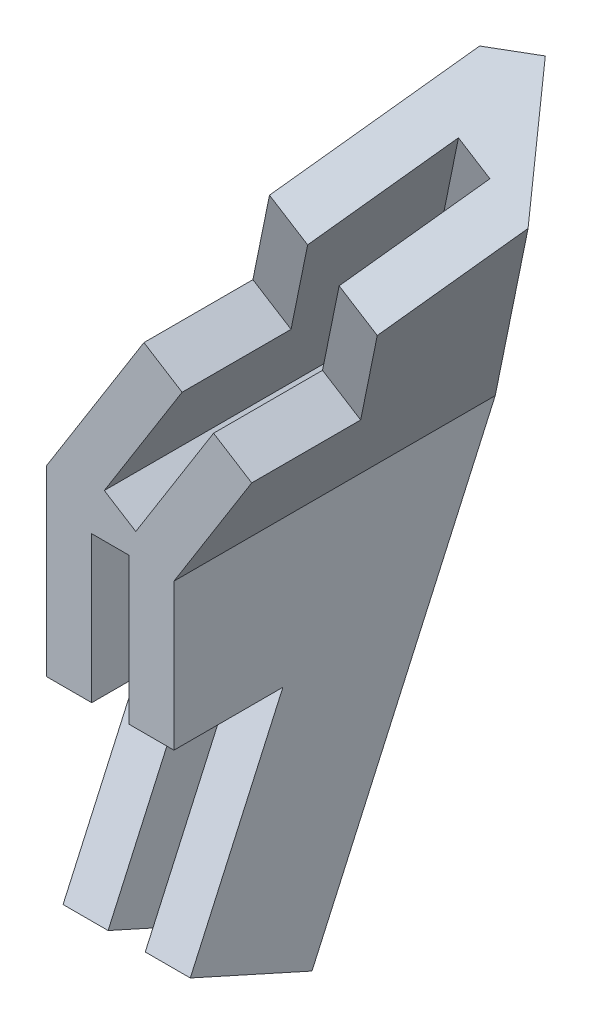
from build123d import *

# Parameters (mm, degrees)
BOSS_EXTRUDE3_DEPTH = 30
CUT_EXTRUDE1_DEPTH  = 36.393360959
SKETCH12_W          = 4
SKETCH12_H          = 13
BOSS_EXTRUDE4_DEPTH = 30
BOSS_EXTRUDE9_REACH = 63.617
CUT_EXTRUDE3_DEPTH  = 55.655521025
CUT_EXTRUDE4_REACH  = 52.517


with BuildPart() as part:
    # Sketch7 → Boss-Extrude3 (new body)
    with BuildSketch(Plane.XY):
        Polygon((-1.7, -2), (-1.7, -15), (-5.7, -15), (-5.7, -2), (-9, -2), (-9, -15), (-13, -15), (-13, 1.250897452), align=None)
    extrude(amount=BOSS_EXTRUDE3_DEPTH)

    # Sketch11 → Cut-Extrude1 (cut, through all)
    with BuildSketch(Plane.ZY.offset(13)):
        Polygon((0, 1.250897452), (7.323081285, -15), (0, -15), align=None)
    extrude(amount=-CUT_EXTRUDE1_DEPTH, mode=Mode.SUBTRACT)

    # Sketch12 → Boss-Extrude4 (add, along a direction that is not the sketch's normal)
    with BuildSketch(Plane(origin=(0, -15, 0), x_dir=(-1, 0, 0), z_dir=(0, -1, 0))):
        with Locations((11, -13.823081285)):
            Rectangle(SKETCH12_W, SKETCH12_H)
        with Locations((3.7, -13.823081285)):
            Rectangle(SKETCH12_W, SKETCH12_H)
    extrude(amount=BOSS_EXTRUDE4_DEPTH, dir=(0, -0.9117077113862475, 0.4108394443074459))

    # Boss-Extrude9: up to this plane
    boss_extrude9_end = Plane(origin=(-1.7, -2, 30), z_dir=(-0.27647610983397475, -0.9610207909775272, 0))
    # Sketch18 → Boss-Extrude9 (add, up to the surface)
    with BuildSketch(Plane(origin=(0, -42.351231342, 0), x_dir=(-1, 0, 0), z_dir=(0, -1, 0)), mode=Mode.PRIVATE) as boss_extrude9_sk1:
        Polygon((1.7, -19.648264614), (13, -19.648264614), (13, -8.348264614), align=None)
    boss_extrude9_tool1 = split(extrude(boss_extrude9_sk1.sketch, amount=BOSS_EXTRUDE9_REACH, dir=(0, 0.911707711386, -0.410839444307), mode=Mode.PRIVATE), bisect_by=boss_extrude9_end, keep=Keep.BOTH, mode=Mode.PRIVATE)
    add(boss_extrude9_tool1.solids().sort_by_distance((-9.233333, -42.351231, 15.881598))[0])

    # Sketch19 → Cut-Extrude3 (cut, through all)
    with BuildSketch(Plane.ZY.offset(13)):
        Polygon((8.348264614, -42.351231342), (28.546690724, -33.249289946), (32.648264614, -42.351231342), align=None)
    extrude(amount=-CUT_EXTRUDE3_DEPTH, mode=Mode.SUBTRACT)

    # Cut-Extrude4: up to this plane
    cut_extrude4_end = Plane(origin=(-1.7, -2, 30), z_dir=(-0.27647610983397475, -0.9610207909775272, 0))
    # Sketch20 → Cut-Extrude4 (cut, up to the surface)
    with BuildSketch(Plane(origin=(0, -38.329779101, 17.272405344), x_dir=(-1, 0, 0), z_dir=(0, -0.9117077113862475, 0.4108394443074459)), mode=Mode.PRIVATE) as cut_extrude4_sk1:
        Polygon((13, 9.788379124), (10.050437985, 7.09924069), (13, 4.149152479), align=None)
    cut_extrude4_tool1 = split(extrude(cut_extrude4_sk1.sketch, amount=-CUT_EXTRUDE4_REACH, mode=Mode.PRIVATE), bisect_by=cut_extrude4_end, keep=Keep.BOTH, mode=Mode.PRIVATE)
    add(cut_extrude4_tool1.solids().sort_by_distance((-12.016813, -41.210691, 10.879276))[0], mode=Mode.SUBTRACT)

    # Mirror3: part across plane


with BuildPart() as part_1:
    add(part.part)
    add(part.part.mirror(Plane(origin=(-1.7, -2, 30), x_dir=(0, 0, 1), z_dir=(-0.27647610983397475, -0.9610207909775272, 0))))


solid = part_1.part
